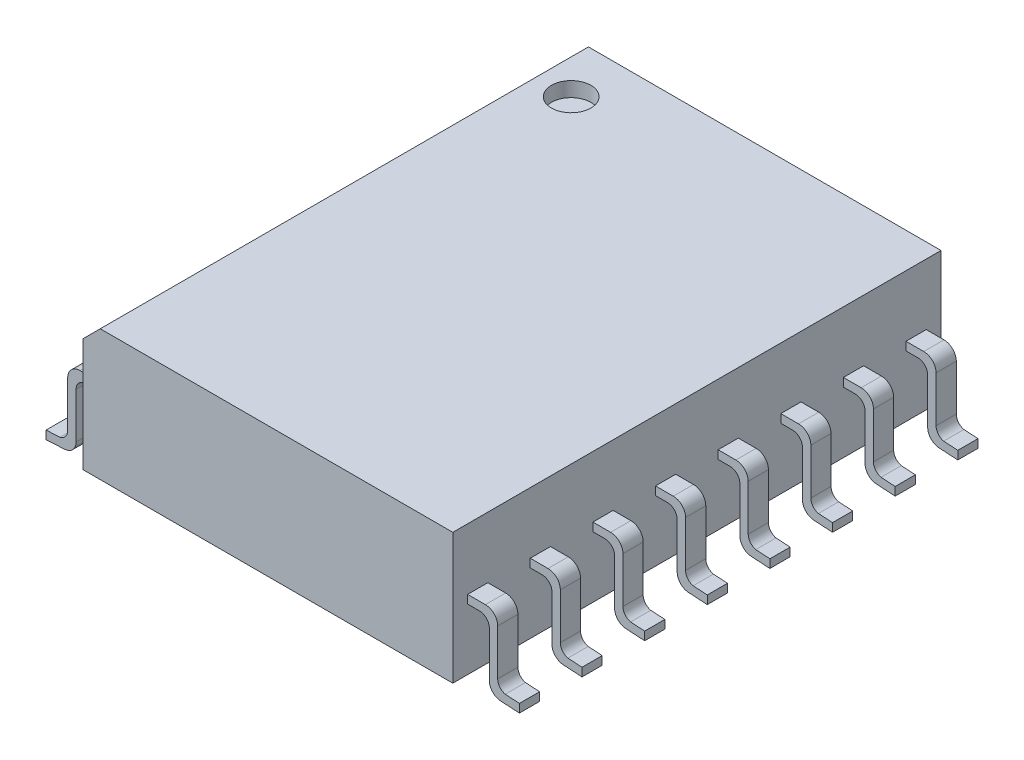
from build123d import *

# Parameters (mm, degrees)
SKETCH2_W            = 7.5
SKETCH2_H            = 9.9
BODY_DEPTH           = 2.65
LEAD_DEPTH           = 0.205
SD_LEADS_COUNT       = 8
SD_LEADS_PITCH       = 1.27
MIRROR1_COPY_1_DEPTH = 0.205
MIRROR1_COPY_2_DEPTH = 0.205
MIRROR1_COPY_3_DEPTH = 0.205
MIRROR1_COPY_4_DEPTH = 0.205
MIRROR1_COPY_5_DEPTH = 0.205
MIRROR1_COPY_6_DEPTH = 0.205
MIRROR1_COPY_7_DEPTH = 0.205
SKETCH4_R            = 0.4
CUT_EXTRUDE1_DEPTH   = 0.3
CHAMFER1_SIZE        = 0.35


with BuildPart() as part:
    # Sketch2 → Body (new body)
    with BuildSketch(Plane(origin=(0, 0.15, 0), x_dir=(1, 0, 0), z_dir=(0, 1, 0))):
        Rectangle(SKETCH2_W, SKETCH2_H)
    extrude(amount=BODY_DEPTH)

    # Sketch3 → Lead (add, symmetric)
    with BuildSketch(Plane.XY.offset(4.445)):
        with BuildLine():
            Line((3.75, 1.56), (4.110208153, 1.56))
            ThreePointArc((4.110208153, 1.56), (4.286837662, 1.486837662), (4.36, 1.310208153))
            Line((4.36, 1.310208153), (4.36, 0.382336704))
            ThreePointArc((4.36, 0.382336704), (4.402955115, 0.258494449), (4.513369039, 0.187848777))
            Line((4.513369039, 0.187848777), (4.8, 0.170317677))
            Line((4.8, 0.170317677), (4.8, 0))
            Line((4.8, 0), (4.419735905, 0.023257948))
            ThreePointArc((4.419735905, 0.023257948), (4.256460215, 0.099829069), (4.19, 0.267474908))
            Line((4.19, 0.267474908), (4.19, 1.19))
            ThreePointArc((4.19, 1.19), (4.131421356, 1.331421356), (3.99, 1.39))
            Line((3.99, 1.39), (3.75, 1.39))
            Line((3.75, 1.39), (3.75, 1.56))
        make_face()
    lead = extrude(amount=LEAD_DEPTH, both=True)

    # SD_Leads: Lead ×8
    with Locations(*[(0, 0, -i * SD_LEADS_PITCH) for i in range(1, SD_LEADS_COUNT)]):
        add(lead)

    # Mirror1: Lead across plane
    add(lead.mirror(Plane(origin=(0, 0, 0), x_dir=(0, 0, 1), z_dir=(1, 0, 0))))

    # Mirror1 copy 1 sketch → Mirror1 copy 1 (add, symmetric)
    with BuildSketch(Plane(origin=(0, 0, 3.175), x_dir=(-1, 0, 0), z_dir=(0, 0, 1))):
        with BuildLine():
            Line((3.75, -1.56), (4.110208153, -1.56))
            ThreePointArc((4.110208153, -1.56), (4.286837662, -1.486837662), (4.36, -1.310208153))
            Line((4.36, -1.310208153), (4.36, -0.382336704))
            ThreePointArc((4.36, -0.382336704), (4.402955115, -0.258494449), (4.513369039, -0.187848777))
            Line((4.513369039, -0.187848777), (4.8, -0.170317677))
            Line((4.8, -0.170317677), (4.8, 0))
            Line((4.8, 0), (4.419735905, -0.023257948))
            ThreePointArc((4.419735905, -0.023257948), (4.256460215, -0.099829069), (4.19, -0.267474908))
            Line((4.19, -0.267474908), (4.19, -1.19))
            ThreePointArc((4.19, -1.19), (4.131421356, -1.331421356), (3.99, -1.39))
            Line((3.99, -1.39), (3.75, -1.39))
            Line((3.75, -1.39), (3.75, -1.56))
        make_face()
    extrude(amount=MIRROR1_COPY_1_DEPTH, both=True)

    # Mirror1 copy 2 sketch → Mirror1 copy 2 (add, symmetric)
    with BuildSketch(Plane(origin=(0, 0, 1.905), x_dir=(-1, 0, 0), z_dir=(0, 0, 1))):
        with BuildLine():
            Line((3.75, -1.56), (4.110208153, -1.56))
            ThreePointArc((4.110208153, -1.56), (4.286837662, -1.486837662), (4.36, -1.310208153))
            Line((4.36, -1.310208153), (4.36, -0.382336704))
            ThreePointArc((4.36, -0.382336704), (4.402955115, -0.258494449), (4.513369039, -0.187848777))
            Line((4.513369039, -0.187848777), (4.8, -0.170317677))
            Line((4.8, -0.170317677), (4.8, 0))
            Line((4.8, 0), (4.419735905, -0.023257948))
            ThreePointArc((4.419735905, -0.023257948), (4.256460215, -0.099829069), (4.19, -0.267474908))
            Line((4.19, -0.267474908), (4.19, -1.19))
            ThreePointArc((4.19, -1.19), (4.131421356, -1.331421356), (3.99, -1.39))
            Line((3.99, -1.39), (3.75, -1.39))
            Line((3.75, -1.39), (3.75, -1.56))
        make_face()
    extrude(amount=MIRROR1_COPY_2_DEPTH, both=True)

    # Mirror1 copy 3 sketch → Mirror1 copy 3 (add, symmetric)
    with BuildSketch(Plane(origin=(0, 0, 0.635), x_dir=(-1, 0, 0), z_dir=(0, 0, 1))):
        with BuildLine():
            Line((3.75, -1.56), (4.110208153, -1.56))
            ThreePointArc((4.110208153, -1.56), (4.286837662, -1.486837662), (4.36, -1.310208153))
            Line((4.36, -1.310208153), (4.36, -0.382336704))
            ThreePointArc((4.36, -0.382336704), (4.402955115, -0.258494449), (4.513369039, -0.187848777))
            Line((4.513369039, -0.187848777), (4.8, -0.170317677))
            Line((4.8, -0.170317677), (4.8, 0))
            Line((4.8, 0), (4.419735905, -0.023257948))
            ThreePointArc((4.419735905, -0.023257948), (4.256460215, -0.099829069), (4.19, -0.267474908))
            Line((4.19, -0.267474908), (4.19, -1.19))
            ThreePointArc((4.19, -1.19), (4.131421356, -1.331421356), (3.99, -1.39))
            Line((3.99, -1.39), (3.75, -1.39))
            Line((3.75, -1.39), (3.75, -1.56))
        make_face()
    extrude(amount=MIRROR1_COPY_3_DEPTH, both=True)

    # Mirror1 copy 4 sketch → Mirror1 copy 4 (add, symmetric)
    with BuildSketch(Plane(origin=(0, 0, -0.635), x_dir=(-1, 0, 0), z_dir=(0, 0, 1))):
        with BuildLine():
            Line((3.75, -1.56), (4.110208153, -1.56))
            ThreePointArc((4.110208153, -1.56), (4.286837662, -1.486837662), (4.36, -1.310208153))
            Line((4.36, -1.310208153), (4.36, -0.382336704))
            ThreePointArc((4.36, -0.382336704), (4.402955115, -0.258494449), (4.513369039, -0.187848777))
            Line((4.513369039, -0.187848777), (4.8, -0.170317677))
            Line((4.8, -0.170317677), (4.8, 0))
            Line((4.8, 0), (4.419735905, -0.023257948))
            ThreePointArc((4.419735905, -0.023257948), (4.256460215, -0.099829069), (4.19, -0.267474908))
            Line((4.19, -0.267474908), (4.19, -1.19))
            ThreePointArc((4.19, -1.19), (4.131421356, -1.331421356), (3.99, -1.39))
            Line((3.99, -1.39), (3.75, -1.39))
            Line((3.75, -1.39), (3.75, -1.56))
        make_face()
    extrude(amount=MIRROR1_COPY_4_DEPTH, both=True)

    # Mirror1 copy 5 sketch → Mirror1 copy 5 (add, symmetric)
    with BuildSketch(Plane(origin=(0, 0, -1.905), x_dir=(-1, 0, 0), z_dir=(0, 0, 1))):
        with BuildLine():
            Line((3.75, -1.56), (4.110208153, -1.56))
            ThreePointArc((4.110208153, -1.56), (4.286837662, -1.486837662), (4.36, -1.310208153))
            Line((4.36, -1.310208153), (4.36, -0.382336704))
            ThreePointArc((4.36, -0.382336704), (4.402955115, -0.258494449), (4.513369039, -0.187848777))
            Line((4.513369039, -0.187848777), (4.8, -0.170317677))
            Line((4.8, -0.170317677), (4.8, 0))
            Line((4.8, 0), (4.419735905, -0.023257948))
            ThreePointArc((4.419735905, -0.023257948), (4.256460215, -0.099829069), (4.19, -0.267474908))
            Line((4.19, -0.267474908), (4.19, -1.19))
            ThreePointArc((4.19, -1.19), (4.131421356, -1.331421356), (3.99, -1.39))
            Line((3.99, -1.39), (3.75, -1.39))
            Line((3.75, -1.39), (3.75, -1.56))
        make_face()
    extrude(amount=MIRROR1_COPY_5_DEPTH, both=True)

    # Mirror1 copy 6 sketch → Mirror1 copy 6 (add, symmetric)
    with BuildSketch(Plane(origin=(0, 0, -3.175), x_dir=(-1, 0, 0), z_dir=(0, 0, 1))):
        with BuildLine():
            Line((3.75, -1.56), (4.110208153, -1.56))
            ThreePointArc((4.110208153, -1.56), (4.286837662, -1.486837662), (4.36, -1.310208153))
            Line((4.36, -1.310208153), (4.36, -0.382336704))
            ThreePointArc((4.36, -0.382336704), (4.402955115, -0.258494449), (4.513369039, -0.187848777))
            Line((4.513369039, -0.187848777), (4.8, -0.170317677))
            Line((4.8, -0.170317677), (4.8, 0))
            Line((4.8, 0), (4.419735905, -0.023257948))
            ThreePointArc((4.419735905, -0.023257948), (4.256460215, -0.099829069), (4.19, -0.267474908))
            Line((4.19, -0.267474908), (4.19, -1.19))
            ThreePointArc((4.19, -1.19), (4.131421356, -1.331421356), (3.99, -1.39))
            Line((3.99, -1.39), (3.75, -1.39))
            Line((3.75, -1.39), (3.75, -1.56))
        make_face()
    extrude(amount=MIRROR1_COPY_6_DEPTH, both=True)

    # Mirror1 copy 7 sketch → Mirror1 copy 7 (add, symmetric)
    with BuildSketch(Plane(origin=(0, 0, -4.445), x_dir=(-1, 0, 0), z_dir=(0, 0, 1))):
        with BuildLine():
            Line((3.75, -1.56), (4.110208153, -1.56))
            ThreePointArc((4.110208153, -1.56), (4.286837662, -1.486837662), (4.36, -1.310208153))
            Line((4.36, -1.310208153), (4.36, -0.382336704))
            ThreePointArc((4.36, -0.382336704), (4.402955115, -0.258494449), (4.513369039, -0.187848777))
            Line((4.513369039, -0.187848777), (4.8, -0.170317677))
            Line((4.8, -0.170317677), (4.8, 0))
            Line((4.8, 0), (4.419735905, -0.023257948))
            ThreePointArc((4.419735905, -0.023257948), (4.256460215, -0.099829069), (4.19, -0.267474908))
            Line((4.19, -0.267474908), (4.19, -1.19))
            ThreePointArc((4.19, -1.19), (4.131421356, -1.331421356), (3.99, -1.39))
            Line((3.99, -1.39), (3.75, -1.39))
            Line((3.75, -1.39), (3.75, -1.56))
        make_face()
    extrude(amount=MIRROR1_COPY_7_DEPTH, both=True)

    # Sketch4 → Cut-Extrude1 (cut)
    with BuildSketch(Plane(origin=(0, 2.8, 0), x_dir=(1, 0, 0), z_dir=(0, 1, 0))):
        with Locations(Location((-2.700802538, 3.900802538, 0), (0, 0, 270))):
            Circle(SKETCH4_R)
    extrude(amount=-CUT_EXTRUDE1_DEPTH, mode=Mode.SUBTRACT)

    # Chamfer1
    chamfer1_edges = [part.edges().sort_by_distance(p)[0] for p in [
        (-3.75, 2.8, 0),
    ]]
    chamfer(chamfer1_edges, length=CHAMFER1_SIZE)


solid = part.part
